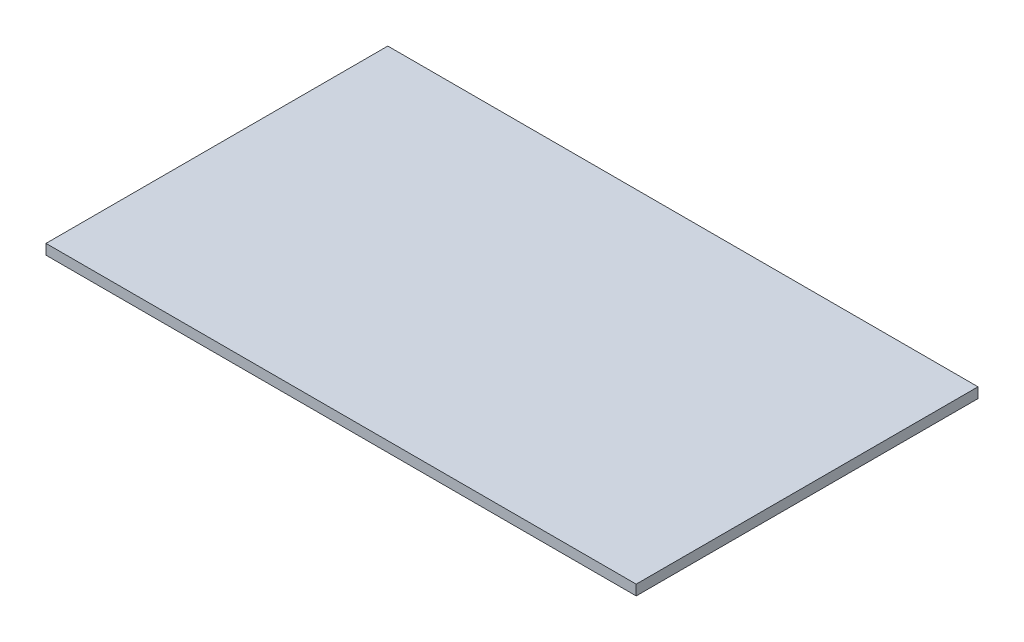
from build123d import *

# Parameters (mm, degrees)
ESQUISSE1_W        = 1036
ESQUISSE1_H        = 600
BOSS_EXTRU_1_DEPTH = 18


with BuildPart() as part:
    # Esquisse1 → Boss.-Extru.1 (new body)
    with BuildSketch(Plane(origin=(0, 0, 0), x_dir=(1, 0, 0), z_dir=(0, 1, 0))):
        Rectangle(ESQUISSE1_W, ESQUISSE1_H)
    extrude(amount=BOSS_EXTRU_1_DEPTH)


solid = part.part
